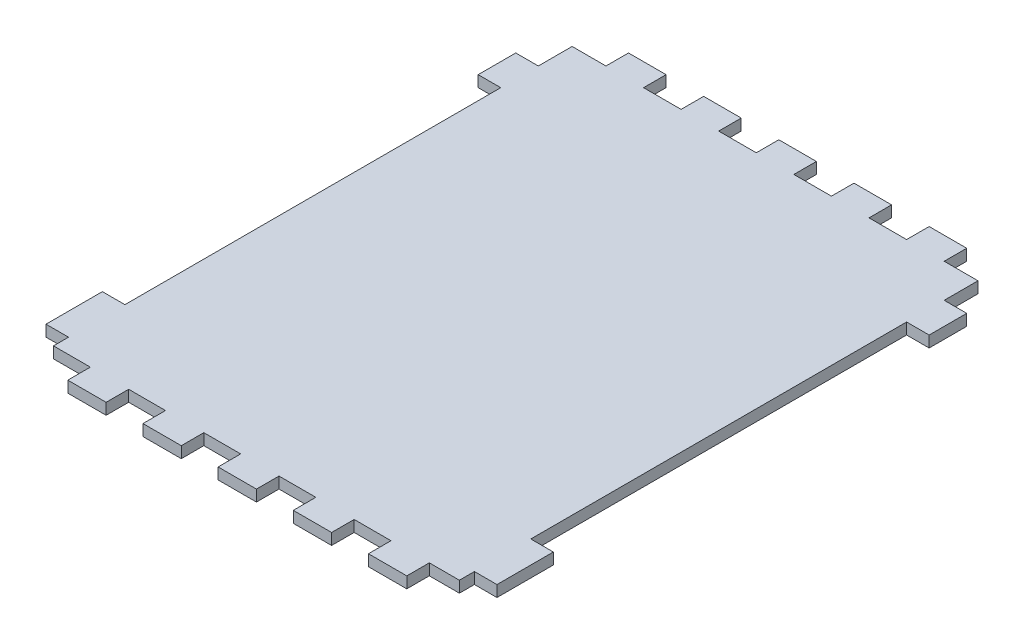
from build123d import *

# Parameters (mm, degrees)
SKETCH_1_W          = 108
SKETCH_1_H          = 138
EXTRUDE_1_DEPTH     = 4
SKETCH_3_W          = 108
SKETCH_3_H          = 138
CUT_EXTRUDE_2_DEPTH = 1
SKETCH_4_W          = 10
SKETCH_4_H          = 3
EXTRUDE_2_DEPTH     = 6
SKETCH_5_W          = 10
SKETCH_5_H          = 3
SKETCH_5_W_2        = 15
EXTRUDE_3_DEPTH     = 6
SKETCH_6_W          = 15
SKETCH_6_H          = 3
SKETCH_6_W_2        = 10
EXTRUDE_4_DEPTH     = 6
SKETCH_7_W          = 10
SKETCH_7_H          = 3
EXTRUDE_5_DEPTH     = 6
SKETCH_8_W          = 6
SKETCH_8_H          = 3
EXTRUDE_6_DEPTH     = 0.2
SKETCH_9_W          = 6
SKETCH_9_H          = 3
EXTRUDE_7_DEPTH     = 0.2
SKETCH_10_W         = 6
SKETCH_10_H         = 3
EXTRUDE_8_DEPTH     = 0.2
SKETCH_11_W         = 6
SKETCH_11_H         = 3
EXTRUDE_9_DEPTH     = 0.2
SKETCH_12_W         = 6
SKETCH_12_H         = 3
EXTRUDE_10_DEPTH    = 0.2


with BuildPart() as part:
    # Эскиз1 → Бобышка-Вытянуть1 (new body)
    with BuildSketch(Plane(origin=(0, 0, 0), x_dir=(1, 0, 0), z_dir=(0, 1, 0))):
        with Locations((54, -69)):
            Rectangle(SKETCH_1_W, SKETCH_1_H)
    extrude(amount=EXTRUDE_1_DEPTH)

    # Эскиз3 → Вырез-Вытянуть2 (cut)
    with BuildSketch(Plane.XZ):
        with Locations((54, 69)):
            Rectangle(SKETCH_3_W, SKETCH_3_H)
    extrude(amount=-CUT_EXTRUDE_2_DEPTH, mode=Mode.SUBTRACT)

    # Эскиз4 → Бобышка-Вытянуть2 (add)
    with BuildSketch(Plane.XY.offset(138)):
        with Locations((15, 2.5)):
            Rectangle(SKETCH_4_W, SKETCH_4_H)
        with Locations((35, 2.5)):
            Rectangle(SKETCH_4_W, SKETCH_4_H)
        with Locations((55, 2.5)):
            Rectangle(SKETCH_4_W, SKETCH_4_H)
        with Locations((75, 2.5)):
            Rectangle(SKETCH_4_W, SKETCH_4_H)
        with Locations((95, 2.5)):
            Rectangle(SKETCH_4_W, SKETCH_4_H)
    extrude(amount=EXTRUDE_2_DEPTH)

    # Эскиз5 → Бобышка-Вытянуть3 (add)
    with BuildSketch(Plane.ZY):
        with Locations((14, 2.5)):
            Rectangle(SKETCH_5_W, SKETCH_5_H)
        with Locations((126.5, 2.5)):
            Rectangle(SKETCH_5_W_2, SKETCH_5_H)
    extrude(amount=EXTRUDE_3_DEPTH)

    # Эскиз6 → Бобышка-Вытянуть4 (add)
    with BuildSketch(Plane(origin=(108, 0, 0), x_dir=(0, 0, -1), z_dir=(1, 0, 0))):
        with Locations((-126.5, 2.5)):
            Rectangle(SKETCH_6_W, SKETCH_6_H)
        with Locations((-14, 2.5)):
            Rectangle(SKETCH_6_W_2, SKETCH_6_H)
    extrude(amount=EXTRUDE_4_DEPTH)

    # Эскиз7 → Бобышка-Вытянуть5 (add)
    with BuildSketch(Plane(origin=(0, 0, 0), x_dir=(-1, 0, 0), z_dir=(0, 0, -1))):
        with Locations((-94, 2.5)):
            Rectangle(SKETCH_7_W, SKETCH_7_H)
        with Locations((-74, 2.5)):
            Rectangle(SKETCH_7_W, SKETCH_7_H)
        with Locations((-54, 2.5)):
            Rectangle(SKETCH_7_W, SKETCH_7_H)
        with Locations((-34, 2.5)):
            Rectangle(SKETCH_7_W, SKETCH_7_H)
        with Locations((-14, 2.5)):
            Rectangle(SKETCH_7_W, SKETCH_7_H)
    extrude(amount=EXTRUDE_5_DEPTH)

    # Эскиз8 → Бобышка-Вытянуть6 (add)
    with BuildSketch(Plane.ZY.offset(-10)):
        with Locations((141, 2.5)):
            Rectangle(SKETCH_8_W, SKETCH_8_H)
    extrude(amount=EXTRUDE_6_DEPTH)

    # Эскиз9 → Бобышка-Вытянуть7 (add)
    with BuildSketch(Plane.ZY.offset(-30)):
        with Locations((141, 2.5)):
            Rectangle(SKETCH_9_W, SKETCH_9_H)
    extrude(amount=EXTRUDE_7_DEPTH)

    # Эскиз10 → Бобышка-Вытянуть8 (add)
    with BuildSketch(Plane.ZY.offset(-50)):
        with Locations((141, 2.5)):
            Rectangle(SKETCH_10_W, SKETCH_10_H)
    extrude(amount=EXTRUDE_8_DEPTH)

    # Эскиз11 → Бобышка-Вытянуть9 (add)
    with BuildSketch(Plane.ZY.offset(-70)):
        with Locations((141, 2.5)):
            Rectangle(SKETCH_11_W, SKETCH_11_H)
    extrude(amount=EXTRUDE_9_DEPTH)

    # Эскиз12 → Бобышка-Вытянуть10 (add)
    with BuildSketch(Plane.ZY.offset(-90)):
        with Locations((141, 2.5)):
            Rectangle(SKETCH_12_W, SKETCH_12_H)
    extrude(amount=EXTRUDE_10_DEPTH)


solid = part.part
